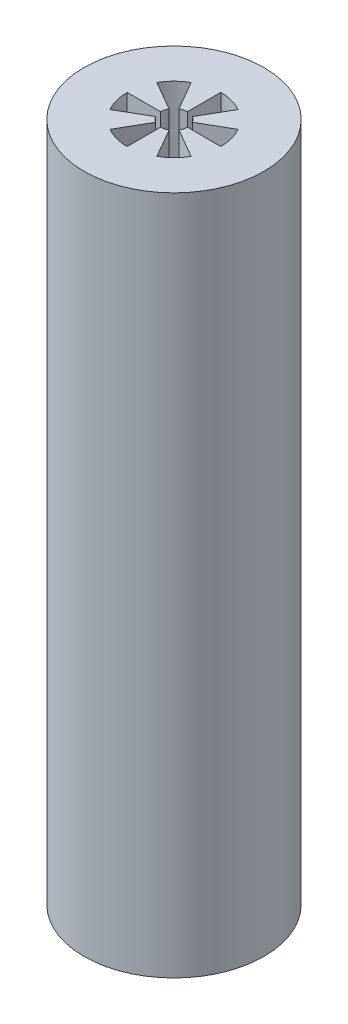
from build123d import *

# Parameters (mm, degrees)
SKETCH1_R           = 42.672
BOSS_EXTRUDE1_DEPTH = 322.58


with BuildPart() as part:
    # Sketch1 → Boss-Extrude1 (new body)
    with BuildSketch(Plane(origin=(0, 0, 0), x_dir=(1, 0, 0), z_dir=(0, 1, 0))):
        with Locations(Location((0, 0, 0), (0, 0, 270))):
            Circle(SKETCH1_R)
        with BuildLine():
            Line((0, 6.35), (0, 22.225))
            ThreePointArc((0, 22.225), (5.752253277, 21.467701489), (11.1125, 19.247414599))
            Line((11.1125, 19.247414599), (3.175, 5.499261314))
            ThreePointArc((3.175, 5.499261314), (4.490128061, 4.490128061), (5.499261314, 3.175))
            Line((5.499261314, 3.175), (19.247414599, 11.1125))
            ThreePointArc((19.247414599, 11.1125), (21.467701489, 5.752253277), (22.225, 0))
            Line((22.225, 0), (6.35, 0))
            ThreePointArc((6.35, 0), (6.133628997, -1.643500936), (5.499261314, -3.175))
            Line((5.499261314, -3.175), (19.247414599, -11.1125))
            ThreePointArc((19.247414599, -11.1125), (15.715448212, -15.715448212), (11.1125, -19.247414599))
            Line((11.1125, -19.247414599), (3.175, -5.499261314))
            ThreePointArc((3.175, -5.499261314), (1.643500936, -6.133628997), (0, -6.35))
            Line((0, -6.35), (0, -22.225))
            ThreePointArc((0, -22.225), (-5.752253277, -21.467701489), (-11.1125, -19.247414599))
            Line((-11.1125, -19.247414599), (-3.175, -5.499261314))
            ThreePointArc((-3.175, -5.499261314), (-4.490128061, -4.490128061), (-5.499261314, -3.175))
            Line((-5.499261314, -3.175), (-19.247414599, -11.1125))
            ThreePointArc((-19.247414599, -11.1125), (-21.467701489, -5.752253277), (-22.225, 0))
            Line((-22.225, 0), (-6.35, 0))
            ThreePointArc((-6.35, 0), (-6.133628997, 1.643500936), (-5.499261314, 3.175))
            Line((-5.499261314, 3.175), (-19.247414599, 11.1125))
            ThreePointArc((-19.247414599, 11.1125), (-15.715448212, 15.715448212), (-11.1125, 19.247414599))
            Line((-11.1125, 19.247414599), (-3.175, 5.499261314))
            ThreePointArc((-3.175, 5.499261314), (-1.643500936, 6.133628997), (0, 6.35))
        make_face(mode=Mode.SUBTRACT)
    extrude(amount=BOSS_EXTRUDE1_DEPTH)


solid = part.part
